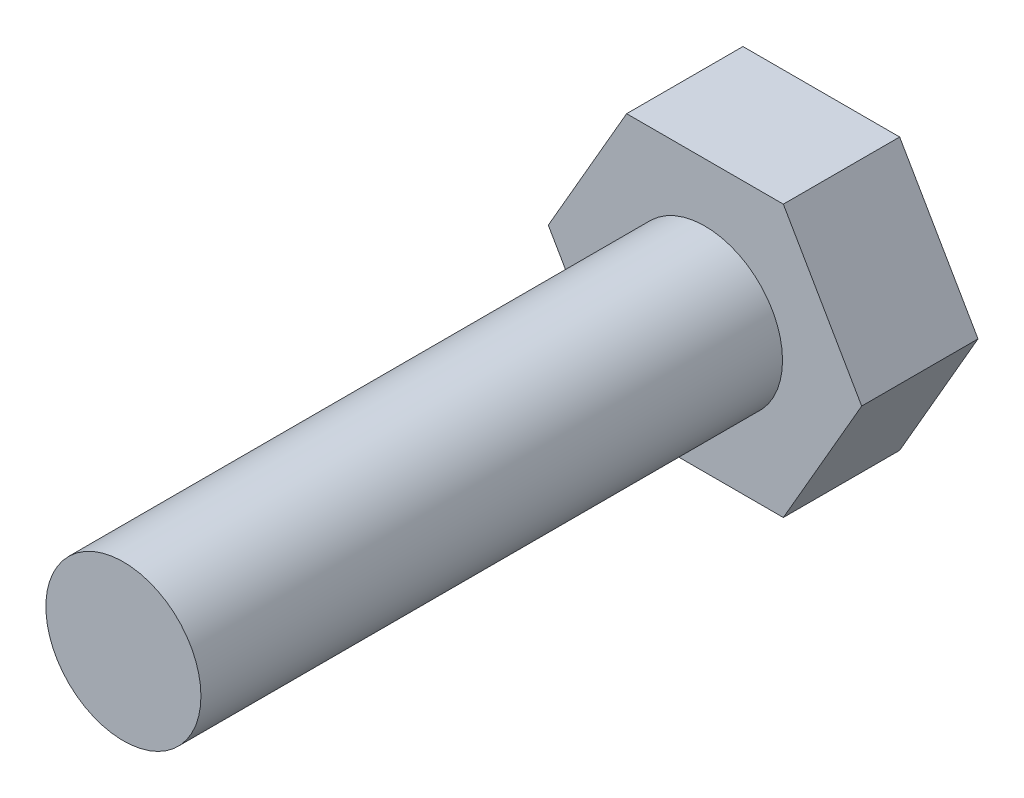
from build123d import *

# Parameters (mm, degrees)
BOSS_EXTRUDE1_DEPTH = 3
SKETCH2_R           = 2
BOSS_EXTRUDE2_DEPTH = 15


with BuildPart() as part:
    # Sketch1 → Boss-Extrude1 (new body)
    with BuildSketch(Plane.XY):
        Polygon((4.041451884, 0), (2.020725942, 3.5), (-2.020725942, 3.5), (-4.041451884, 0), (-2.020725942, -3.5), (2.020725942, -3.5), align=None)
    extrude(amount=BOSS_EXTRUDE1_DEPTH)

    # Sketch2 → Boss-Extrude2 (add)
    with BuildSketch(Plane.XY.offset(3)):
        Circle(SKETCH2_R)
    extrude(amount=BOSS_EXTRUDE2_DEPTH)


solid = part.part
